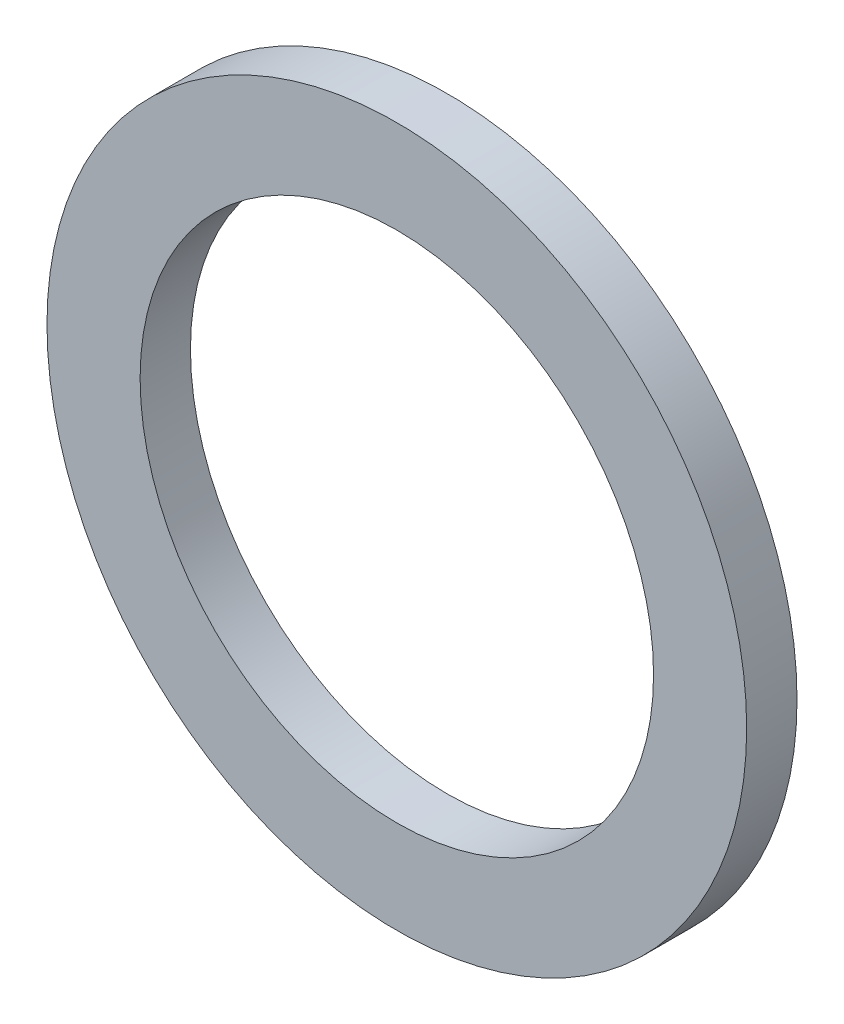
from build123d import *

# Parameters (mm, degrees)
SKETCH3_R           = 6.95
SKETCH3_R_2         = 5.1
BOSS_EXTRUDE1_DEPTH = 0.5


with BuildPart() as part:
    # Sketch3 → Boss-Extrude1 (new, symmetric)
    with BuildSketch(Plane.XY):
        Circle(SKETCH3_R)
        Circle(SKETCH3_R_2, mode=Mode.SUBTRACT)
    extrude(amount=BOSS_EXTRUDE1_DEPTH, both=True)


solid = part.part
